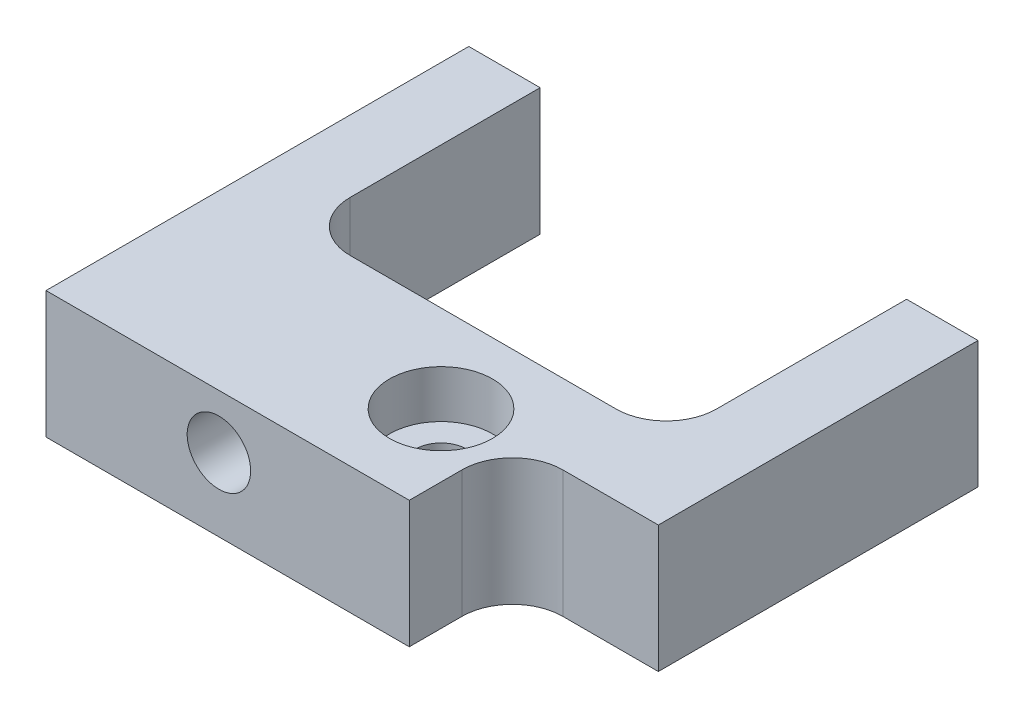
from build123d import *

# Parameters (mm, degrees)
BOSS_EXTRUDE1_DEPTH            = 4
FILLET1_R                      = 3.175
CUT_EXTRUDE1_DEPTH             = 30.864067037
CUT_EXTRUDE1_DEPTH_BACK        = 30.864067037
SKETCH2_R                      = 2
CUT_EXTRUDE2_DEPTH             = 4.5
CUT_EXTRUDE2_DEPTH_BACK        = 30.864067037
SKETCH3_R                      = 2
F_1_5_1_5_DIAMETER_HOLE1_D     = 1.5
F_1_5_1_5_DIAMETER_HOLE1_DEPTH = 7
F_1_5_1_5_DIAMETER_HOLE1_TIP   = 0.450645464
CBORE_FOR_M3_SHCS1_D           = 3.2
CBORE_FOR_M3_SHCS1_CBORE_D     = 6.5
CBORE_FOR_M3_SHCS1_CBORE_DEPTH = 3


with BuildPart() as part:
    # Sketch1 → Boss-Extrude1 (new, symmetric)
    with BuildSketch(Plane(origin=(0, 0, 0), x_dir=(1, 0, 0), z_dir=(0, 1, 0))):
        Polygon((12, 0.5), (12, -6), (-10.9, -6), (-10.9, 20.65), (-6.4, 20.65), (-6.4, 5.5), (16.7, 5.5), (16.7, 20.65), (21.2, 20.65), (21.2, 0.5), align=None)
    extrude(amount=BOSS_EXTRUDE1_DEPTH, both=True)

    # Fillet1
    fillet1_edges = [part.edges().sort_by_distance(p)[0] for p in [
        (12, 0, -0.5),
        (-6.4, 0, -5.5),
        (16.7, 0, -5.5),
    ]]
    fillet(fillet1_edges, radius=FILLET1_R)

    # Sketch2 → Cut-Extrude1 (cut, two sides: drawn at the far end of the back side and taken through both)
    with BuildSketch(Plane.XY.offset(-CUT_EXTRUDE1_DEPTH_BACK)):
        with Locations((0, 0.6)):
            Circle(SKETCH2_R)
    extrude(amount=CUT_EXTRUDE1_DEPTH + CUT_EXTRUDE1_DEPTH_BACK, mode=Mode.SUBTRACT)

    # Sketch3 → Cut-Extrude2 (cut, two sides: drawn at the far end of the back side and taken through both)
    with BuildSketch(Plane(origin=(0, 0, 0), x_dir=(0, 0, -1), z_dir=(1, 0, 0)).offset(-CUT_EXTRUDE2_DEPTH_BACK)):
        with Locations((0, -0.6)):
            Circle(SKETCH3_R)
    extrude(amount=CUT_EXTRUDE2_DEPTH + CUT_EXTRUDE2_DEPTH_BACK, mode=Mode.SUBTRACT)

    # Ø1.5 (1.5) Diameter Hole1
    with Locations(Plane(origin=(0, 0, -20.65), x_dir=(-1, 0, 0), z_dir=(0, 0, -1))):
        with Locations((-19.05, 0.6), (8.75, 0.6)):
            Hole(F_1_5_1_5_DIAMETER_HOLE1_D / 2, depth=F_1_5_1_5_DIAMETER_HOLE1_DEPTH)
            with Locations((0, 0, -(F_1_5_1_5_DIAMETER_HOLE1_DEPTH + F_1_5_1_5_DIAMETER_HOLE1_TIP / 2))):  # 118° drill point
                Cone(0, F_1_5_1_5_DIAMETER_HOLE1_D / 2, F_1_5_1_5_DIAMETER_HOLE1_TIP, mode=Mode.SUBTRACT)

    # CBORE for M3 SHCS1 (through all)
    with Locations(Plane(origin=(0, 4, 0), x_dir=(1, 0, 0), z_dir=(0, 1, 0))):
        with Locations((8, 0)):
            CounterBoreHole(CBORE_FOR_M3_SHCS1_D / 2, CBORE_FOR_M3_SHCS1_CBORE_D / 2, CBORE_FOR_M3_SHCS1_CBORE_DEPTH)


solid = part.part
